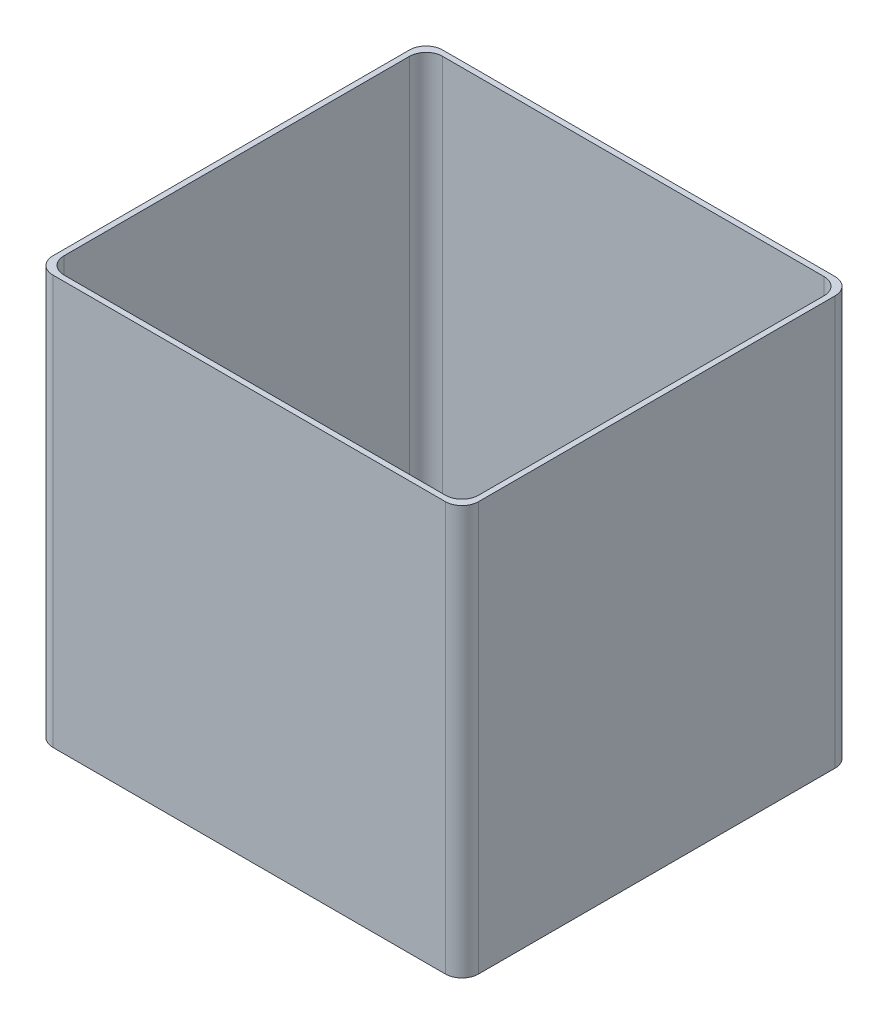
from build123d import *

# Parameters (mm, degrees)
SKETCH1_W           = 154
SKETCH1_H           = 141
SKETCH1_W_2         = 150
SKETCH1_H_2         = 137
BOSS_EXTRUDE1_DEPTH = 148
SKETCH4_W           = 150
SKETCH4_H           = 137
BOSS_EXTRUDE2_DEPTH = 2
FILLET1_R           = 6
FILLET2_R           = 6
FILLET3_R           = 6
FILLET4_R           = 6
FILLET5_R           = 6
FILLET6_R           = 6
FILLET7_R           = 6
FILLET8_R           = 6


with BuildPart() as part:
    # Sketch1 → Boss-Extrude1 (new body)
    with BuildSketch(Plane(origin=(0, 0, 0), x_dir=(1, 0, 0), z_dir=(0, 1, 0))):
        with Locations((-14.096869638, 39.113007283)):
            Rectangle(SKETCH1_W, SKETCH1_H)
        with Locations((-14.096869638, 39.113007283)):
            Rectangle(SKETCH1_W_2, SKETCH1_H_2, mode=Mode.SUBTRACT)
    extrude(amount=BOSS_EXTRUDE1_DEPTH)

    # Sketch4 → Boss-Extrude2 (add)
    with BuildSketch(Plane.XZ):
        with Locations((-14.096869638, -39.113007283)):
            Rectangle(SKETCH4_W, SKETCH4_H)
    extrude(amount=-BOSS_EXTRUDE2_DEPTH)

    # Fillet1
    fillet1_edges = [part.edges().sort_by_distance(p)[0] for p in [
        (62.903130362, 74, 31.386992717),
    ]]
    fillet(fillet1_edges, radius=FILLET1_R)

    # Fillet2
    fillet2_edges = [part.edges().sort_by_distance(p)[0] for p in [
        (60.903130362, 75, 29.386992717),
    ]]
    fillet(fillet2_edges, radius=FILLET2_R)

    # Fillet3
    fillet3_edges = [part.edges().sort_by_distance(p)[0] for p in [
        (-89.096869638, 75, 29.386992717),
    ]]
    fillet(fillet3_edges, radius=FILLET3_R)

    # Fillet4
    fillet4_edges = [part.edges().sort_by_distance(p)[0] for p in [
        (-91.096869638, 74, 31.386992717),
    ]]
    fillet(fillet4_edges, radius=FILLET4_R)

    # Fillet5
    fillet5_edges = [part.edges().sort_by_distance(p)[0] for p in [
        (62.903130362, 74, -109.613007283),
    ]]
    fillet(fillet5_edges, radius=FILLET5_R)

    # Fillet6
    fillet6_edges = [part.edges().sort_by_distance(p)[0] for p in [
        (-91.096869638, 74, -109.613007283),
    ]]
    fillet(fillet6_edges, radius=FILLET6_R)

    # Fillet7
    fillet7_edges = [part.edges().sort_by_distance(p)[0] for p in [
        (-89.096869638, 75, -107.613007283),
    ]]
    fillet(fillet7_edges, radius=FILLET7_R)

    # Fillet8
    fillet8_edges = [part.edges().sort_by_distance(p)[0] for p in [
        (60.903130362, 75, -107.613007283),
    ]]
    fillet(fillet8_edges, radius=FILLET8_R)


solid = part.part
